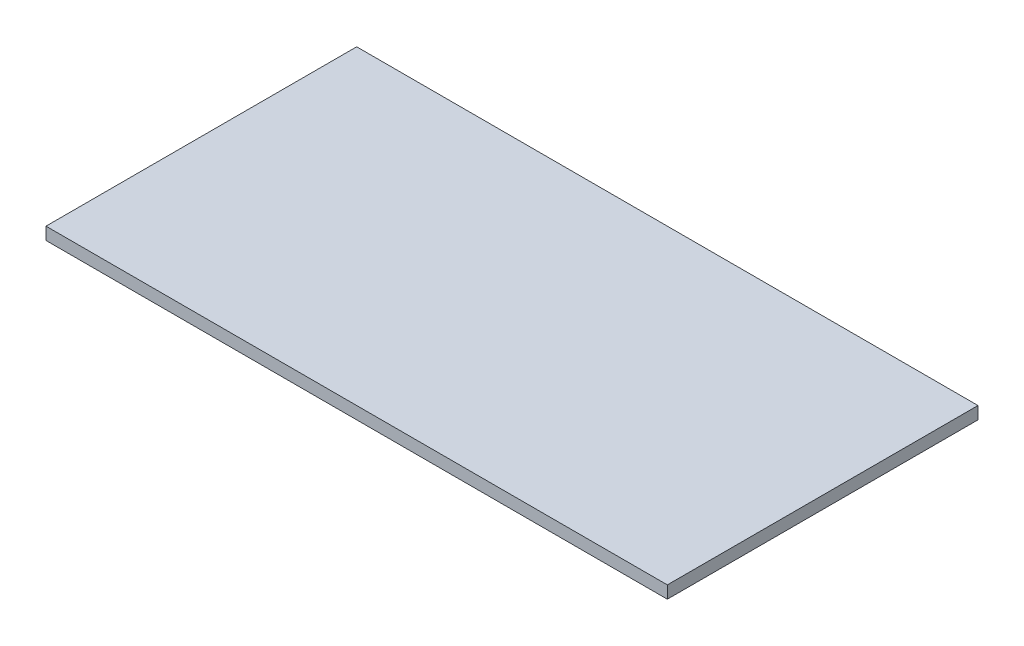
from build123d import *

# Parameters (mm, degrees)
SKETCH2_W           = 80
SKETCH2_H           = 40
BOSS_EXTRUDE1_DEPTH = 1.6


with BuildPart() as part:
    # Sketch2 → Boss-Extrude1 (new body)
    with BuildSketch(Plane(origin=(0, 0, 0), x_dir=(1, 0, 0), z_dir=(0, 1, 0))):
        Rectangle(SKETCH2_W, SKETCH2_H)
    extrude(amount=BOSS_EXTRUDE1_DEPTH)


solid = part.part
